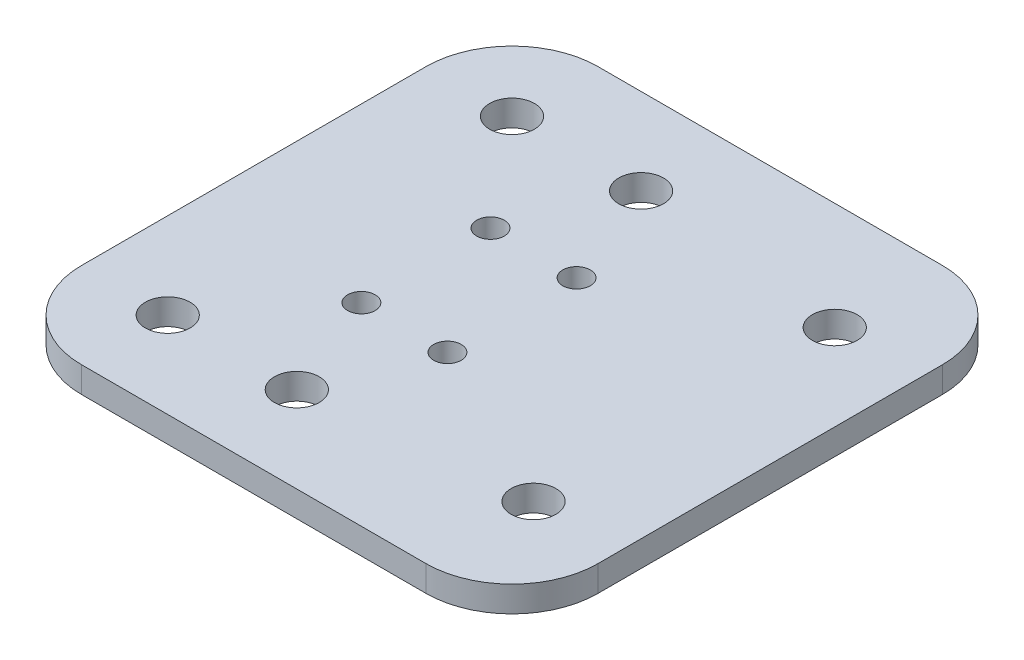
from build123d import *

# Parameters (mm, degrees)
EXTRUDE_1_DEPTH     = 3
SKETCH_2_R          = 1.6
SKETCH_2_R_2        = 2.6
CUT_EXTRUDE_1_DEPTH = 68.149087857
FILLET_1_R          = 10


with BuildPart() as part:
    # 草图1 → 凸台-拉伸1 (new body)
    with BuildSketch(Plane(origin=(0, 0, 0), x_dir=(1, 0, 0), z_dir=(0, 1, 0))):
        Polygon((0, -30), (0, 30), (21.715728753, 30), (60, 30), (60, -30), (21.715728753, -30), align=None)
    extrude(amount=EXTRUDE_1_DEPTH)

    # 草图2 → 切除-拉伸1 (cut, through all)
    with BuildSketch(Plane(origin=(0, 3, 0), x_dir=(1, 0, 0), z_dir=(0, 1, 0))):
        with Locations(Location((20, 7.5, 0), (0, 0, 270))):
            Circle(SKETCH_2_R)
        with Locations(Location((30, 7.5, 0), (0, 0, 270))):
            Circle(SKETCH_2_R)
        with Locations(Location((30, -7.5, 0), (0, 0, 90))):
            Circle(SKETCH_2_R)
        with Locations(Location((20, -7.5, 0), (0, 0, 90))):
            Circle(SKETCH_2_R)
        with Locations(Location((10, 20, 0), (0, 0, 270))):
            Circle(SKETCH_2_R_2)
        with Locations(Location((10, -20, 0), (0, 0, 270))):
            Circle(SKETCH_2_R_2)
        with Locations(Location((25, 20, 0), (0, 0, 270))):
            Circle(SKETCH_2_R_2)
        with Locations(Location((25, -20, 0), (0, 0, 270))):
            Circle(SKETCH_2_R_2)
        with Locations(Location((50, 17.5, 0), (0, 0, 270))):
            Circle(SKETCH_2_R_2)
        with Locations(Location((50, -17.5, 0), (0, 0, 270))):
            Circle(SKETCH_2_R_2)
    extrude(amount=-CUT_EXTRUDE_1_DEPTH, mode=Mode.SUBTRACT)

    # 圆角1
    fillet_1_edges = [part.edges().sort_by_distance(p)[0] for p in [
        (60, 1.5, -30),
        (60, 1.5, 30),
        (0, 1.5, 30),
        (0, 1.5, -30),
    ]]
    fillet(fillet_1_edges, radius=FILLET_1_R)


solid = part.part
